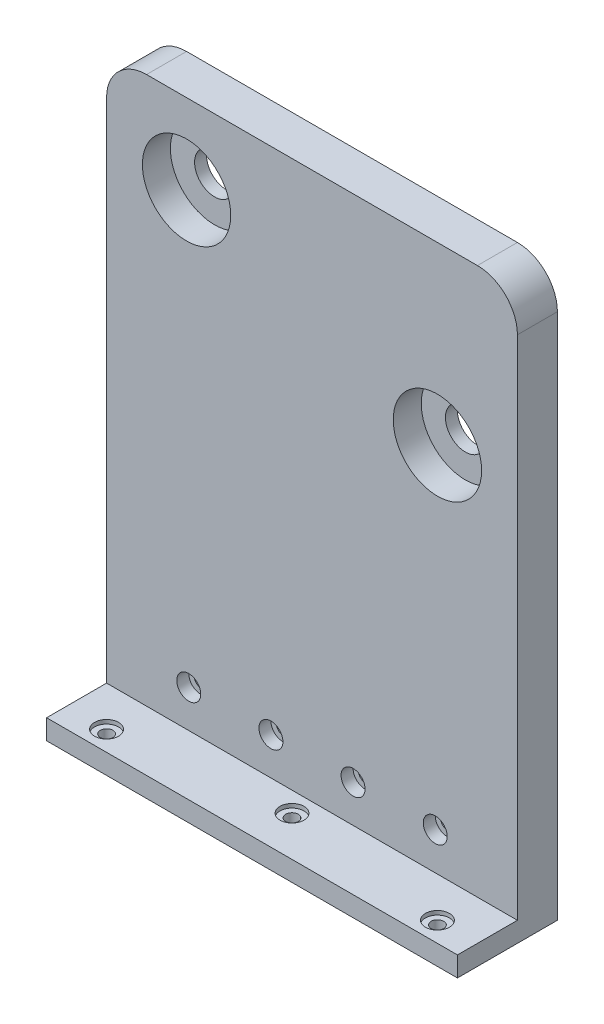
from build123d import *

# Parameters (mm, degrees)
SKETCH2_R           = 11.05
BOSS_EXTRUDE2_DEPTH = 10
SKETCH2_4_R         = 11.05
SKETCH2_4_R_2       = 5
BOSS_EXTRUDE3_DEPTH = 3
SKETCH4_R           = 1.6
CUT_EXTRUDE3_DEPTH  = 10
SKETCH4_5_R         = 3
SKETCH4_5_R_2       = 1.6
CUT_EXTRUDE4_DEPTH  = 3
SKETCH5_W           = 92.15
SKETCH5_H           = 21.15
SKETCH5_W_2         = 87.95
SKETCH5_H_2         = 16.95
CUT_EXTRUDE5_DEPTH  = 3
SKETCH6_W           = 102.73844499
SKETCH6_H           = 25
BOSS_EXTRUDE4_DEPTH = 5
SKETCH7_R           = 1.575
CUT_EXTRUDE6_DEPTH  = 5
SKETCH7_3_R         = 3
SKETCH7_3_R_2       = 1.575
CUT_EXTRUDE7_DEPTH  = 1


with BuildPart() as part:
    # Sketch2 → Boss-Extrude2 (new body)
    with BuildSketch(Plane.XY):
        with BuildLine():
            ThreePointArc((0, -10), (-2.928932188, -2.928932188), (-10, 0))
            Line((-10, 0), (-92.73844499, 0))
            ThreePointArc((-92.73844499, 0), (-99.809512802, -2.928932188), (-102.73844499, -10))
            Line((-102.73844499, -10), (-102.73844499, -141.80223365))
            Line((-102.73844499, -141.80223365), (0, -141.80223365))
            Line((0, -141.80223365), (0, -10))
        make_face()
        with Locations((-82.73844499, -20)):
            Circle(SKETCH2_R, mode=Mode.SUBTRACT)
        with Locations((-20, -43.89848365)):
            Circle(SKETCH2_R, mode=Mode.SUBTRACT)
    extrude(amount=BOSS_EXTRUDE2_DEPTH)

    # Sketch2<4> → Boss-Extrude3 (add)
    # profile 1 of 2: a face of its own
    with BuildSketch(Plane.XY):
        with Locations((-82.73844499, -20)):
            Circle(SKETCH2_4_R)
        with Locations((-82.73844499, -20)):
            Circle(SKETCH2_4_R_2, mode=Mode.SUBTRACT)
    # profile 2 of 2: a face of its own
    with BuildSketch(Plane.XY):
        with Locations((-20, -43.89848365)):
            Circle(SKETCH2_4_R)
        with Locations((-20, -43.89848365)):
            Circle(SKETCH2_4_R_2, mode=Mode.SUBTRACT)
    extrude(amount=BOSS_EXTRUDE3_DEPTH)

    # Sketch4 → Cut-Extrude3 (cut)
    with BuildSketch(Plane.XY.offset(10)):
        with Locations((-82.19075699, -127.45223365)):
            Circle(SKETCH4_R)
        with Locations((-61.64306899, -127.45223365)):
            Circle(SKETCH4_R)
        with Locations((-41.09538099, -127.45223365)):
            Circle(SKETCH4_R)
        with Locations((-20.54769299, -127.45223365)):
            Circle(SKETCH4_R)
    extrude(amount=-CUT_EXTRUDE3_DEPTH, mode=Mode.SUBTRACT)

    # Sketch4<5> → Cut-Extrude4 (cut)
    # profile 1 of 4: a face of its own
    with BuildSketch(Plane.XY.offset(10)):
        with Locations((-82.19075699, -127.45223365)):
            Circle(SKETCH4_5_R)
        with Locations((-82.19075699, -127.45223365)):
            Circle(SKETCH4_5_R_2, mode=Mode.SUBTRACT)
    # profile 2 of 4: a face of its own
    with BuildSketch(Plane.XY.offset(10)):
        with Locations((-61.64306899, -127.45223365)):
            Circle(SKETCH4_5_R)
        with Locations((-61.64306899, -127.45223365)):
            Circle(SKETCH4_5_R_2, mode=Mode.SUBTRACT)
    # profile 3 of 4: a face of its own
    with BuildSketch(Plane.XY.offset(10)):
        with Locations((-41.09538099, -127.45223365)):
            Circle(SKETCH4_5_R)
        with Locations((-41.09538099, -127.45223365)):
            Circle(SKETCH4_5_R_2, mode=Mode.SUBTRACT)
    # profile 4 of 4: a face of its own
    with BuildSketch(Plane.XY.offset(10)):
        with Locations((-20.54769299, -127.45223365)):
            Circle(SKETCH4_5_R)
        with Locations((-20.54769299, -127.45223365)):
            Circle(SKETCH4_5_R_2, mode=Mode.SUBTRACT)
    extrude(amount=-CUT_EXTRUDE4_DEPTH, mode=Mode.SUBTRACT)

    # Sketch5 → Cut-Extrude5 (cut)
    with BuildSketch(Plane(origin=(0, 0, 0), x_dir=(-1, 0, 0), z_dir=(0, 0, -1))):
        with Locations((51.369222495, -127.40223365)):
            Rectangle(SKETCH5_W, SKETCH5_H)
        with Locations((51.369222495, -127.40223365)):
            Rectangle(SKETCH5_W_2, SKETCH5_H_2, mode=Mode.SUBTRACT)
    extrude(amount=-CUT_EXTRUDE5_DEPTH, mode=Mode.SUBTRACT)

    # Sketch6 → Boss-Extrude4 (add)
    with BuildSketch(Plane.XZ.offset(141.80223365)):
        with Locations((-51.369222495, 12.5)):
            Rectangle(SKETCH6_W, SKETCH6_H)
    extrude(amount=-BOSS_EXTRUDE4_DEPTH)

    # Sketch7 → Cut-Extrude6 (cut)
    with BuildSketch(Plane(origin=(0, -136.80223365, 0), x_dir=(1, 0, 0), z_dir=(0, 1, 0))):
        with Locations((-92.73844499, -20)):
            Circle(SKETCH7_R)
        with Locations((-51.369222495, -15)):
            Circle(SKETCH7_R)
        with Locations((-10, -20)):
            Circle(SKETCH7_R)
    extrude(amount=-CUT_EXTRUDE6_DEPTH, mode=Mode.SUBTRACT)

    # Sketch7<3> → Cut-Extrude7 (cut)
    # profile 1 of 3: a face of its own
    with BuildSketch(Plane(origin=(0, -136.80223365, 0), x_dir=(1, 0, 0), z_dir=(0, 1, 0))):
        with Locations((-92.73844499, -20)):
            Circle(SKETCH7_3_R)
        with Locations((-92.73844499, -20)):
            Circle(SKETCH7_3_R_2, mode=Mode.SUBTRACT)
    # profile 2 of 3: a face of its own
    with BuildSketch(Plane(origin=(0, -136.80223365, 0), x_dir=(1, 0, 0), z_dir=(0, 1, 0))):
        with Locations((-51.369222495, -15)):
            Circle(SKETCH7_3_R)
        with Locations((-51.369222495, -15)):
            Circle(SKETCH7_3_R_2, mode=Mode.SUBTRACT)
    # profile 3 of 3: a face of its own
    with BuildSketch(Plane(origin=(0, -136.80223365, 0), x_dir=(1, 0, 0), z_dir=(0, 1, 0))):
        with Locations((-10, -20)):
            Circle(SKETCH7_3_R)
        with Locations((-10, -20)):
            Circle(SKETCH7_3_R_2, mode=Mode.SUBTRACT)
    extrude(amount=-CUT_EXTRUDE7_DEPTH, mode=Mode.SUBTRACT)


solid = part.part
